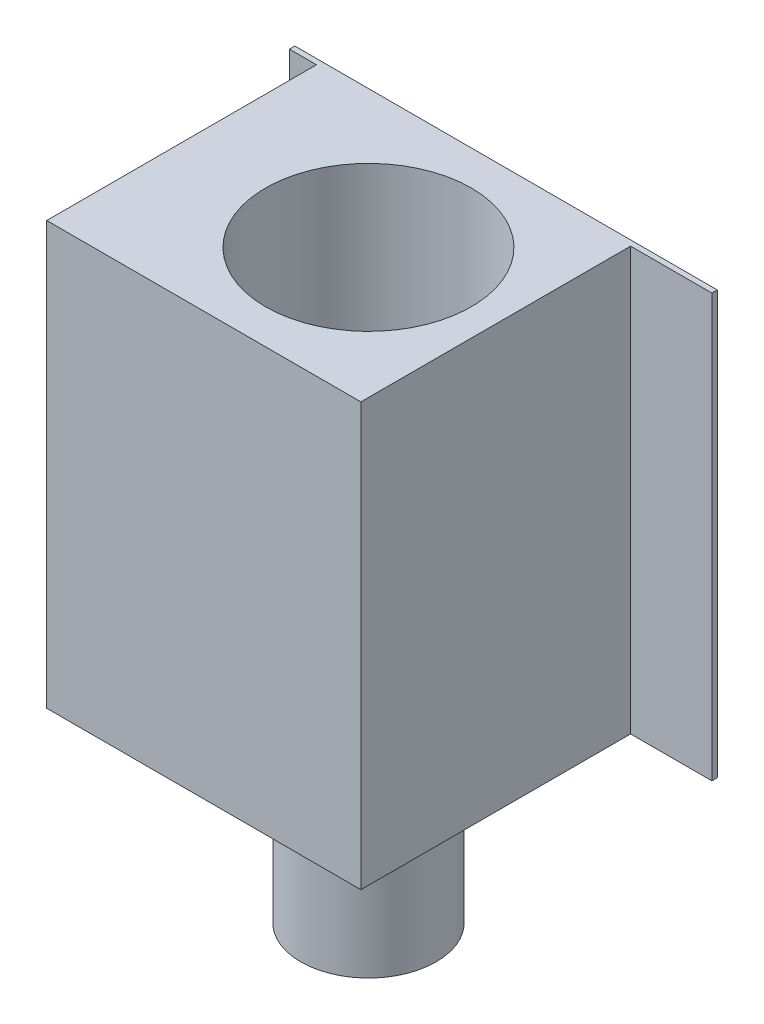
from build123d import *

# Parameters (mm, degrees)
SKETCH_1_W          = 7.8
SKETCH_1_H          = 5.08
EXTRUDE_1_DEPTH     = 7.8
SKETCH_2_R          = 1.9
CUT_EXTRUDE_1_DEPTH = 4.2
SKETCH_3_W          = 2.509058382
SKETCH_3_H          = 0.614954654
CUT_EXTRUDE_2_DEPTH = 0.5
SKETCH_4_R          = 1.25
EXTRUDE_1_2_DEPTH   = 3
SKETCH_5_W          = 0.5
SKETCH_5_H          = 4.98
SKETCH_5_W_2        = 1.5
CUT_EXTRUDE_3_DEPTH = 12.760170067


with BuildPart() as part:
    # 草图1 → Extrude 1 (new body)
    with BuildSketch(Plane(origin=(0, 0, 0), x_dir=(1, 0, 0), z_dir=(0, 1, 0))):
        Rectangle(SKETCH_1_W, SKETCH_1_H)
    extrude(amount=EXTRUDE_1_DEPTH)

    # 草图2 → 切除-拉伸1 (cut)
    with BuildSketch(Plane(origin=(0, 7.8, 0), x_dir=(1, 0, 0), z_dir=(0, 1, 0))):
        with Locations(Location((0, 0, 0), (0, 0, 270))):
            Circle(SKETCH_2_R)
    extrude(amount=-CUT_EXTRUDE_1_DEPTH, mode=Mode.SUBTRACT)

    # 草图3 → 切除-拉伸2 (cut)
    with BuildSketch(Plane(origin=(0, 3.6, 0), x_dir=(1, 0, 0), z_dir=(0, 1, 0))):
        Rectangle(SKETCH_3_W, SKETCH_3_H)
    extrude(amount=-CUT_EXTRUDE_2_DEPTH, mode=Mode.SUBTRACT)

    # 草图4 → Extrude 1 2 (add)
    with BuildSketch(Plane.XZ):
        with Locations(Location((0, 0, 0), (0, 0, 90))):
            Circle(SKETCH_4_R)
    extrude(amount=EXTRUDE_1_2_DEPTH)

    # 草图5 → 切除-拉伸3 (cut, through all)
    with BuildSketch(Plane(origin=(0, 7.8, 0), x_dir=(1, 0, 0), z_dir=(0, 1, 0))):
        with Locations((-3.65, -0.05)):
            Rectangle(SKETCH_5_W, SKETCH_5_H)
        with Locations((3.15, -0.05)):
            Rectangle(SKETCH_5_W_2, SKETCH_5_H)
    extrude(amount=-CUT_EXTRUDE_3_DEPTH, mode=Mode.SUBTRACT)


solid = part.part
